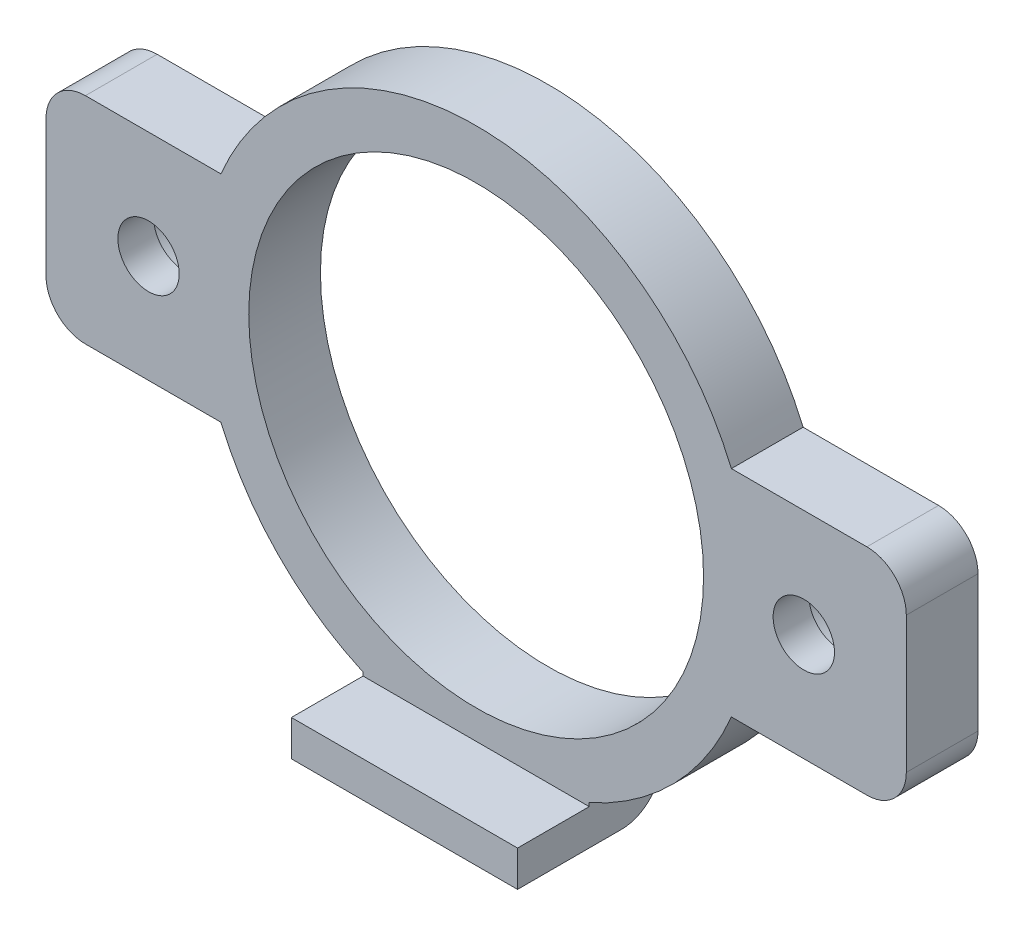
from build123d import *

# Parameters (mm, degrees)
SKETCH_1_R          = 6.344055944
EXTRUDE_2_DEPTH     = 2
SKETCH_1_7_W        = 6.308806274
SKETCH_1_7_H        = 1
EXTRUDE_3_DEPTH     = 4
SKETCH_1_8_R        = 0.855944056
CUT_EXTRUDE_3_DEPTH = 3.5
SKETCH_1_9_R        = 1.51048951
CUT_EXTRUDE_4_DEPTH = 1
FILLET_2_R          = 1.1
FILLET_3_R          = 1.1


with BuildPart() as part:
    # 草图1 → 凸台-拉伸2 (new body)
    with BuildSketch(Plane.XY):
        with BuildLine():
            Line((3.154403137, -7.15), (-3.154403137, -7.15))
            Line((-3.154403137, -7.15), (-3.154403137, -7.053623266))
            ThreePointArc((-3.154403137, -7.053623266), (-5.522881331, -5.403854378), (-7.120664318, -3))
            Line((-7.120664318, -3), (-12, -3))
            Line((-12, -3), (-12, 3))
            Line((-12, 3), (-7.120664318, 3))
            ThreePointArc((-7.120664318, 3), (0, 7.726827314), (7.120664318, 3))
            Line((7.120664318, 3), (12, 3))
            Line((12, 3), (12, -3))
            Line((12, -3), (7.120664318, -3))
            ThreePointArc((7.120664318, -3), (5.522881331, -5.403854378), (3.154403137, -7.053623266))
            Line((3.154403137, -7.053623266), (3.154403137, -7.15))
        make_face()
        Circle(SKETCH_1_R, mode=Mode.SUBTRACT)
    extrude(amount=EXTRUDE_2_DEPTH)

    # 草图1<7> → 凸台-拉伸3 (add)
    with BuildSketch(Plane.XY):
        with Locations((0, -7.65)):
            Rectangle(SKETCH_1_7_W, SKETCH_1_7_H)
    extrude(amount=EXTRUDE_3_DEPTH)

    # 草图1<8> → 切除-拉伸3 (cut)
    with BuildSketch(Plane.XY):
        with Locations((-9.139979315, 0)):
            Circle(SKETCH_1_8_R)
        with Locations((9.139979315, 0)):
            Circle(SKETCH_1_8_R)
    extrude(amount=CUT_EXTRUDE_3_DEPTH, mode=Mode.SUBTRACT)

    # 草图1<9> → 切除-拉伸4 (cut)
    with BuildSketch(Plane.XY):
        with Locations((-9.139979315, 0)):
            Circle(SKETCH_1_9_R)
        with Locations((9.139979315, 0)):
            Circle(SKETCH_1_9_R)
    extrude(amount=CUT_EXTRUDE_4_DEPTH, mode=Mode.SUBTRACT)

    # 圆角2
    fillet_2_edges = [part.edges().sort_by_distance(p)[0] for p in [
        (0, -8.15, 0),
    ]]
    fillet(fillet_2_edges, radius=FILLET_2_R)

    # 圆角3
    fillet_3_edges = [part.edges().sort_by_distance(p)[0] for p in [
        (-12, -3, 1),
        (-12, 3, 1),
        (12, -3, 1),
        (12, 3, 1),
    ]]
    fillet(fillet_3_edges, radius=FILLET_3_R)


solid = part.part
